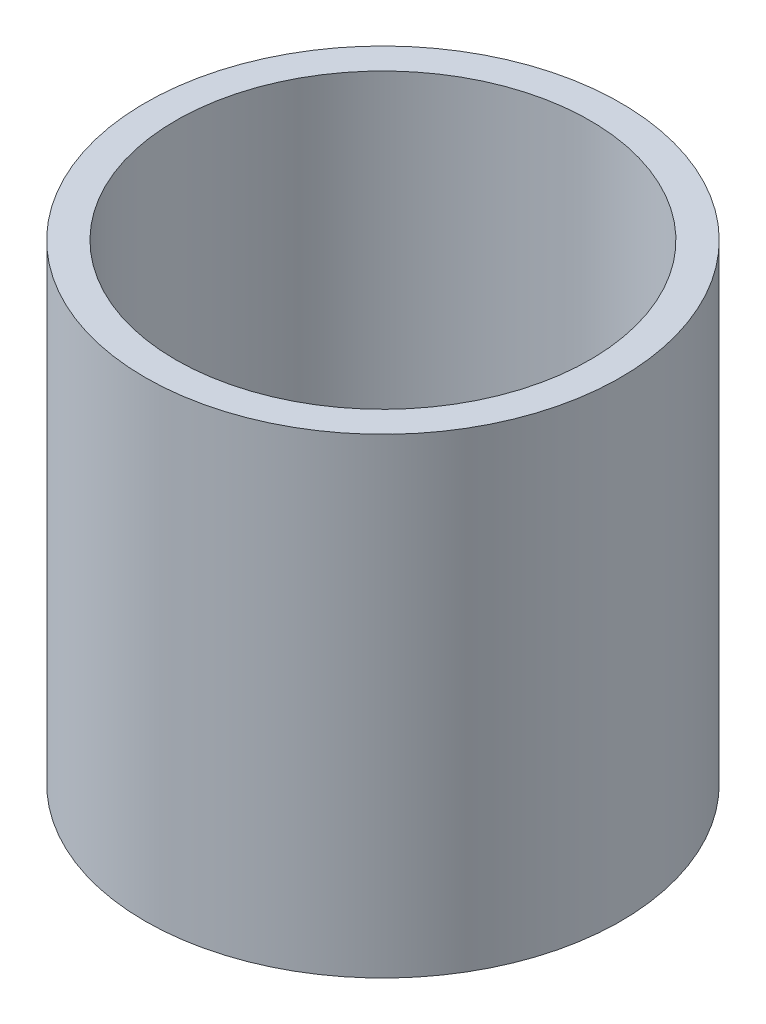
from build123d import *

# Parameters (mm, degrees)
SKETCH1_R           = 6.4135
SKETCH1_R_2         = 5.588
BOSS_EXTRUDE1_DEPTH = 6.35


with BuildPart() as part:
    # Sketch1 → Boss-Extrude1 (new, symmetric)
    with BuildSketch(Plane(origin=(0, 0, 0), x_dir=(1, 0, 0), z_dir=(0, 1, 0))):
        with Locations(Location((0, 0, 0), (0, 0, 270))):
            Circle(SKETCH1_R)
        with Locations(Location((0, 0, 0), (0, 0, 270))):
            Circle(SKETCH1_R_2, mode=Mode.SUBTRACT)
    extrude(amount=BOSS_EXTRUDE1_DEPTH, both=True)


solid = part.part
